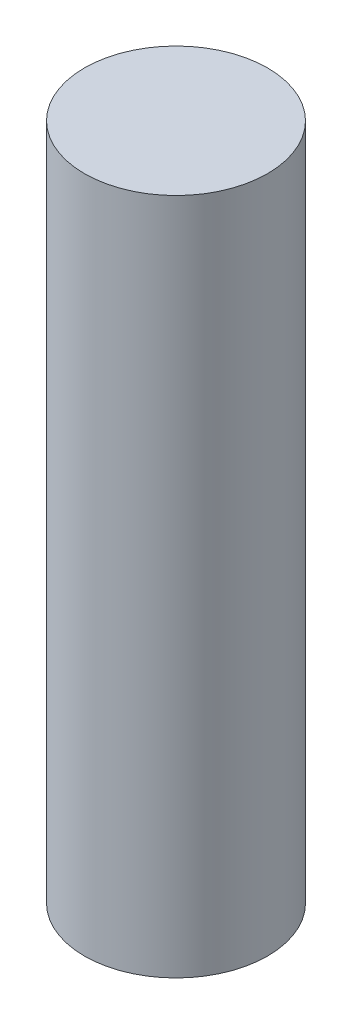
from build123d import *

# Parameters (mm, degrees)
SKETCH1_R           = 12.7
BOSS_EXTRUDE1_DEPTH = 93.98


with BuildPart() as part:
    # Sketch1 → Boss-Extrude1 (new body)
    with BuildSketch(Plane(origin=(0, 0, 0), x_dir=(1, 0, 0), z_dir=(0, 1, 0))):
        with Locations(Location((0, 0, 0), (0, 0, 90))):
            Circle(SKETCH1_R)
    extrude(amount=BOSS_EXTRUDE1_DEPTH)


solid = part.part
